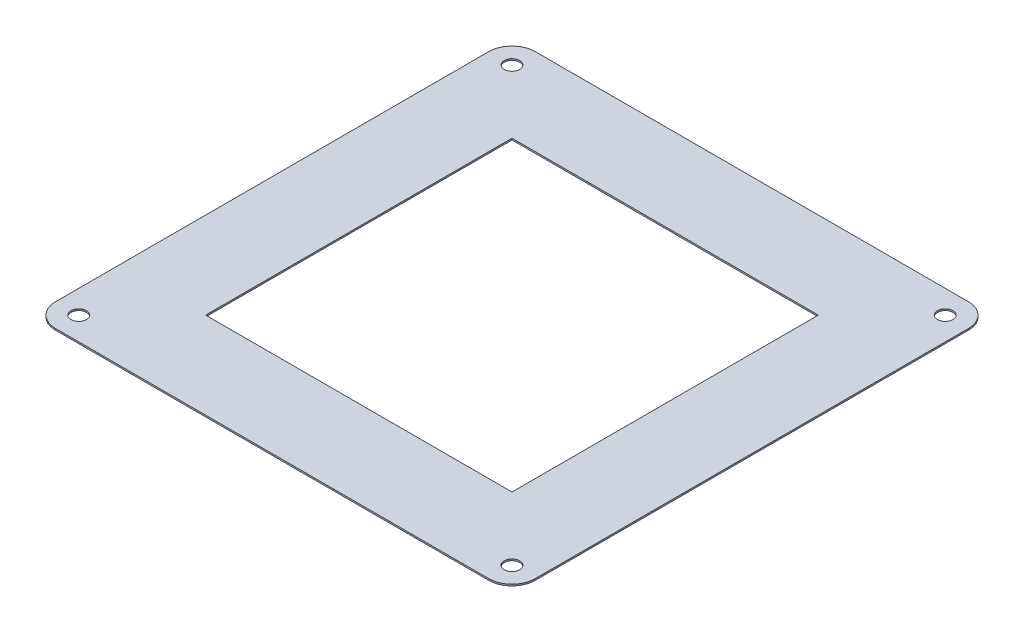
from build123d import *

# Parameters (mm, degrees)
CROQUIS1_R              = 2.5
SALIENTE_EXTRUIR1_DEPTH = 0.5
CROQUIS2_W              = 99
CROQUIS2_H              = 99
CORTAR_EXTRUIR1_DEPTH   = 10


with BuildPart() as part:
    # Croquis1 → Saliente-Extruir1 (new body)
    with BuildSketch(Plane(origin=(0, 0, 0), x_dir=(1, 0, 0), z_dir=(0, 1, 0))):
        with BuildLine():
            Line((17.5, 10), (157.5, 10))
            ThreePointArc((157.5, 10), (162.803300859, 12.196699141), (165, 17.5))
            Line((165, 17.5), (165, 157.5))
            ThreePointArc((165, 157.5), (162.803300859, 162.803300859), (157.5, 165))
            Line((157.5, 165), (17.5, 165))
            ThreePointArc((17.5, 165), (12.196699141, 162.803300859), (10, 157.5))
            Line((10, 157.5), (10, 17.5))
            ThreePointArc((10, 17.5), (12.196699141, 12.196699141), (17.5, 10))
        make_face()
        with Locations(Location((17.5, 157.5, 0), (0, 0, 270))):
            Circle(CROQUIS1_R, mode=Mode.SUBTRACT)
        with Locations(Location((157.5, 157.5, 0), (0, 0, 270))):
            Circle(CROQUIS1_R, mode=Mode.SUBTRACT)
        with Locations(Location((157.5, 17.5, 0), (0, 0, 270))):
            Circle(CROQUIS1_R, mode=Mode.SUBTRACT)
        with Locations(Location((17.5, 17.5, 0), (0, 0, 270))):
            Circle(CROQUIS1_R, mode=Mode.SUBTRACT)
    extrude(amount=SALIENTE_EXTRUIR1_DEPTH)

    # Croquis2 → Cortar-Extruir1 (cut)
    with BuildSketch(Plane(origin=(0, 0.5, 0), x_dir=(1, 0, 0), z_dir=(0, 1, 0))):
        with Locations((87.5, 87.5)):
            Rectangle(CROQUIS2_W, CROQUIS2_H)
    extrude(amount=-CORTAR_EXTRUIR1_DEPTH, mode=Mode.SUBTRACT)


solid = part.part
